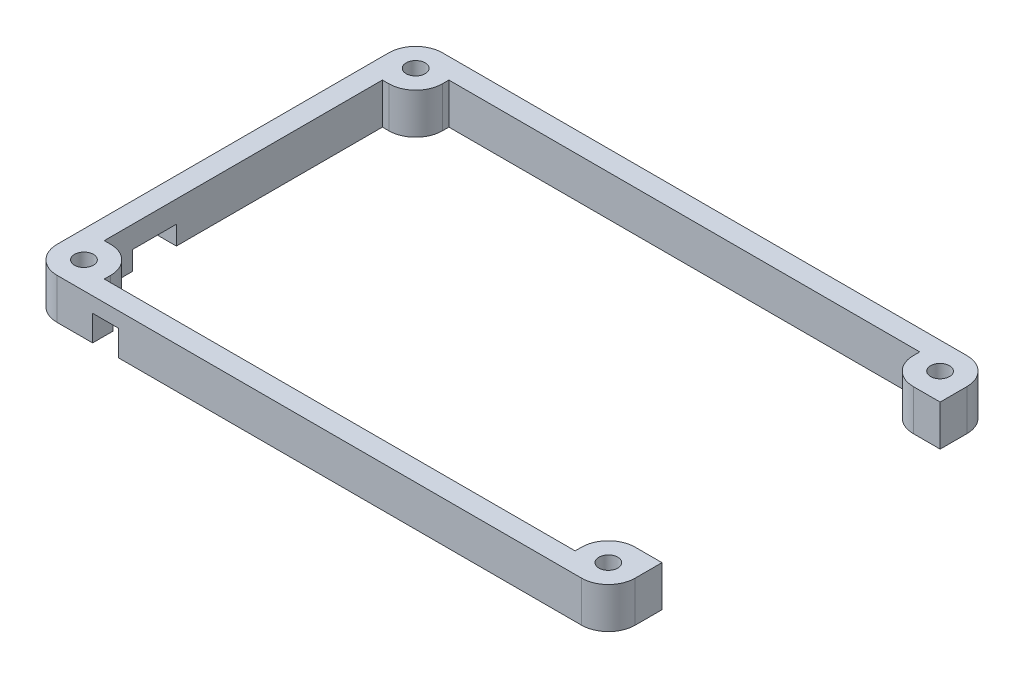
from build123d import *

# Parameters (mm, degrees)
BOSS_EXTRUDE3_DEPTH = 6.35
SKETCH5_W           = 6.8
SKETCH5_H           = 5.9
CUT_EXTRUDE3_DEPTH  = 3.175
SKETCH7_R           = 1.475
SKETCH7_R_2         = 1.4732
CUT_EXTRUDE5_DEPTH  = 6.35
SKETCH8_W           = 3.175
SKETCH8_H           = 43.3
CUT_EXTRUDE6_DEPTH  = 10
SKETCH9_W           = 4
SKETCH9_H           = 4
CUT_EXTRUDE8_DEPTH  = 4


with BuildPart() as part:
    # Sketch2 → Boss-Extrude3 (new body)
    with BuildSketch(Plane(origin=(0, 0, 0), x_dir=(1, 0, 0), z_dir=(0, 1, 0))):
        with BuildLine():
            Line((-45, 25.825), (-45, -25.825))
            ThreePointArc((-45, -25.825), (-43.777170811, -28.777170811), (-40.825, -30))
            Line((-40.825, -30), (40.825, -30))
            ThreePointArc((40.825, -30), (43.777170811, -28.777170811), (45, -25.825))
            Line((45, -25.825), (45, 25.825))
            ThreePointArc((45, 25.825), (43.777170811, 28.777170811), (40.825, 30))
            Line((40.825, 30), (-40.825, 30))
            ThreePointArc((-40.825, 30), (-43.777170811, 28.777170811), (-45, 25.825))
        make_face()
        with BuildLine():
            Line((40.825, 21.65), (41.825, 21.65))
            Line((41.825, 21.65), (41.825, -21.65))
            Line((41.825, -21.65), (40.825, -21.65))
            ThreePointArc((40.825, -21.65), (37.872829189, -22.872829189), (36.65, -25.825))
            Line((36.65, -25.825), (36.65, -26.825))
            Line((36.65, -26.825), (-36.65, -26.825))
            Line((-36.65, -26.825), (-36.65, -25.825))
            ThreePointArc((-36.65, -25.825), (-37.872829189, -22.872829189), (-40.825, -21.65))
            Line((-40.825, -21.65), (-41.825, -21.65))
            Line((-41.825, -21.65), (-41.825, 21.65))
            Line((-41.825, 21.65), (-40.825, 21.65))
            ThreePointArc((-40.825, 21.65), (-37.872829189, 22.872829189), (-36.65, 25.825))
            Line((-36.65, 25.825), (-36.65, 26.825))
            Line((-36.65, 26.825), (36.65, 26.825))
            Line((36.65, 26.825), (36.65, 25.825))
            ThreePointArc((36.65, 25.825), (37.872829189, 22.872829189), (40.825, 21.65))
        make_face(mode=Mode.SUBTRACT)
    extrude(amount=BOSS_EXTRUDE3_DEPTH)

    # Sketch5 → Cut-Extrude3 (cut)
    with BuildSketch(Plane.ZY.offset(45)):
        with Locations((13.825, 0)):
            Rectangle(SKETCH5_W, SKETCH5_H)
    extrude(amount=-CUT_EXTRUDE3_DEPTH, mode=Mode.SUBTRACT)

    # Sketch7 → Cut-Extrude5 (cut)
    with BuildSketch(Plane.XZ):
        with Locations(Location((-40.825, -25.825, 0), (0, 0, 270))):
            Circle(SKETCH7_R)
        with Locations(Location((-40.825, 25.81356336, 0), (0, 0, 270))):
            Circle(SKETCH7_R_2)
        with Locations(Location((40.825, 25.825, 0), (0, 0, 270))):
            Circle(SKETCH7_R_2)
        with Locations(Location((40.825, -25.81487963, 0), (0, 0, 270))):
            Circle(SKETCH7_R_2)
    extrude(amount=-CUT_EXTRUDE5_DEPTH, mode=Mode.SUBTRACT)

    # Sketch8 → Cut-Extrude6 (cut)
    with BuildSketch(Plane(origin=(0, 6.35, 0), x_dir=(1, 0, 0), z_dir=(0, 1, 0))):
        with Locations((43.4125, 0)):
            Rectangle(SKETCH8_W, SKETCH8_H)
    extrude(amount=-CUT_EXTRUDE6_DEPTH, mode=Mode.SUBTRACT)

    # Sketch9 → Cut-Extrude8 (cut)
    with BuildSketch(Plane.XY.offset(30)):
        with Locations((-33.2866, 2)):
            Rectangle(SKETCH9_W, SKETCH9_H)
    extrude(amount=-CUT_EXTRUDE8_DEPTH, mode=Mode.SUBTRACT)


solid = part.part
